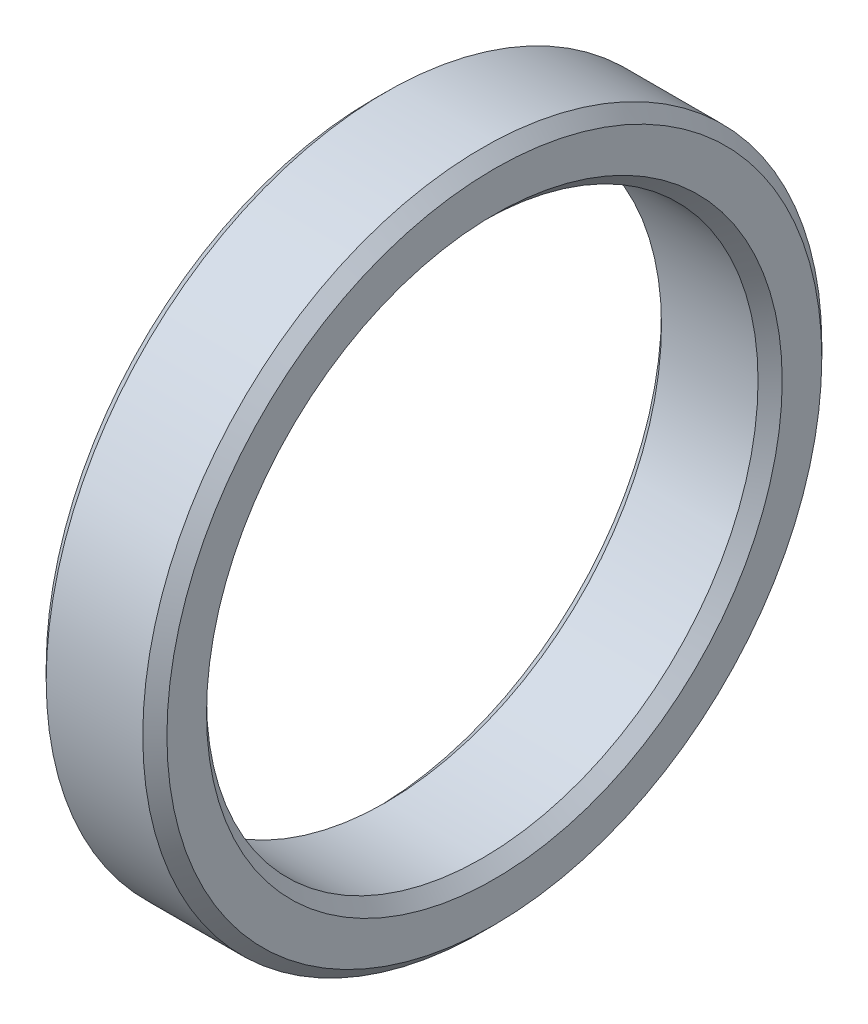
from build123d import *

# Parameters (mm, degrees)
SKETCH1_W     = 12.7
SKETCH1_H     = 6.7056
CHAMFER1_SIZE = 1.27


with BuildPart() as part:
    # Sketch1 → Revolve1 (revolve)
    with BuildSketch(Plane.XY, mode=Mode.PRIVATE) as revolve1_sk:
        with Locations((6.35, 32.36595)):
            Rectangle(SKETCH1_W, SKETCH1_H)
    revolve(revolve1_sk.sketch.rotate(Axis((-88.99, 0, 0), (1, 0, 0)), 90), axis=Axis((-88.99, 0, 0), (1, 0, 0)))

    # Chamfer1
    chamfer1_edges = [part.edges().sort_by_distance(p)[0] for p in [
        (12.7, 0, -29.01315),
        (12.7, 0, -35.71875),
        (0, 0, -35.71875),
        (0, 0, -29.01315),
    ]]
    chamfer(chamfer1_edges, length=CHAMFER1_SIZE)


solid = part.part
